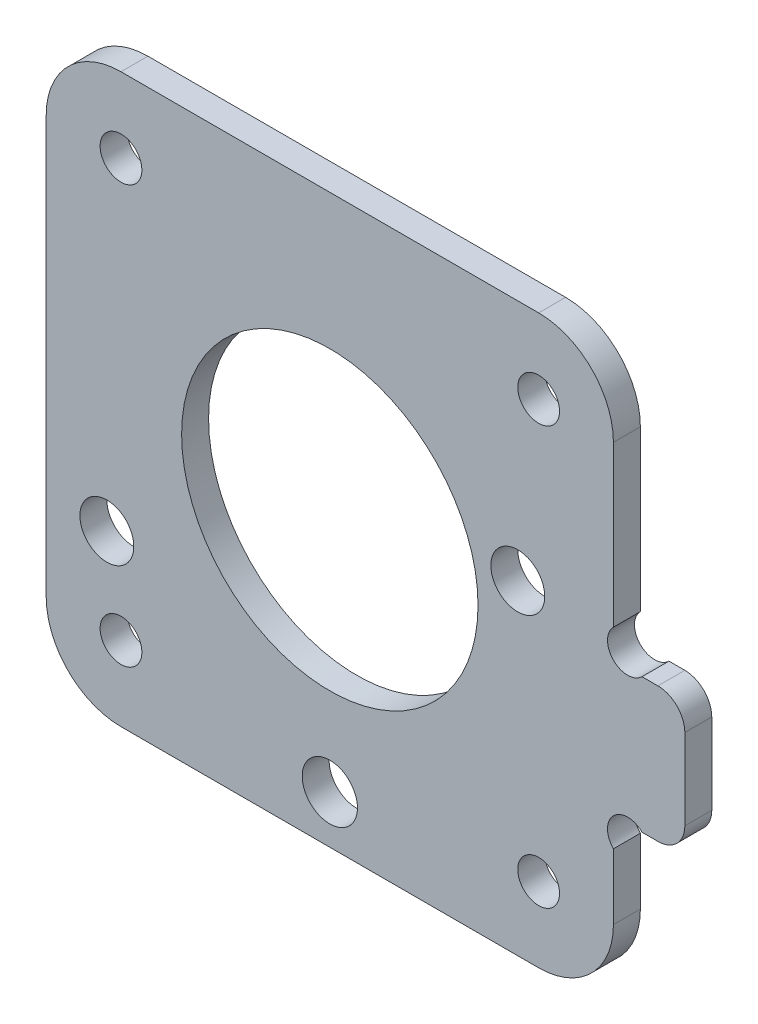
from build123d import *

# Parameters (mm, degrees)
SKETCH1_R           = 11
SKETCH1_R_2         = 1.55
BOSS_EXTRUDE1_DEPTH = 2
SKETCH2_R           = 2.05
CUT_EXTRUDE1_DEPTH  = 30.83630339
SKETCH5_W           = 5.3
SKETCH5_H           = 10
BOSS_EXTRUDE3_DEPTH = 2
FILLET1_R           = 2
SKETCH6_R           = 1.5
CUT_EXTRUDE3_DEPTH  = 34.784981871
SKETCH7_R           = 2
CUT_EXTRUDE6_DEPTH  = 34.784981871


with BuildPart() as part:
    # Sketch1 → Boss-Extrude1 (new body)
    with BuildSketch(Plane.XY):
        with BuildLine():
            Line((-21.05, 15.5), (-21.05, -15.5))
            ThreePointArc((-21.05, -15.5), (-19.424442636, -19.424442636), (-15.5, -21.05))
            Line((-15.5, -21.05), (15.5, -21.05))
            ThreePointArc((15.5, -21.05), (19.424442636, -19.424442636), (21.05, -15.5))
            Line((21.05, -15.5), (21.05, 15.5))
            ThreePointArc((21.05, 15.5), (19.424442636, 19.424442636), (15.5, 21.05))
            Line((15.5, 21.05), (-15.5, 21.05))
            ThreePointArc((-15.5, 21.05), (-19.424442636, 19.424442636), (-21.05, 15.5))
        make_face()
        Circle(SKETCH1_R, mode=Mode.SUBTRACT)
        with Locations((-15.5, -15.5)):
            Circle(SKETCH1_R_2, mode=Mode.SUBTRACT)
        with Locations((15.5, 15.5)):
            Circle(SKETCH1_R_2, mode=Mode.SUBTRACT)
        with Locations(Location((-15.5, 15.5, 0), (0, 0, 180))):
            Circle(SKETCH1_R_2, mode=Mode.SUBTRACT)
        with Locations((15.5, -15.5)):
            Circle(SKETCH1_R_2, mode=Mode.SUBTRACT)
    extrude(amount=BOSS_EXTRUDE1_DEPTH)

    # Sketch2 → Cut-Extrude1 (cut, through all)
    with BuildSketch(Plane.XY.offset(2)):
        with Locations((0, -17.5)):
            Circle(SKETCH2_R)
    extrude(amount=-CUT_EXTRUDE1_DEPTH, mode=Mode.SUBTRACT)

    # Sketch5 → Boss-Extrude3 (add)
    with BuildSketch(Plane(origin=(0, 0, 0), x_dir=(-1, 0, 0), z_dir=(0, 0, -1))):
        with Locations((-23.7, -3.5)):
            Rectangle(SKETCH5_W, SKETCH5_H)
    extrude(amount=-BOSS_EXTRUDE3_DEPTH)

    # Fillet1
    fillet1_edges = [part.edges().sort_by_distance(p)[0] for p in [
        (26.35, -8.5, 1),
        (26.35, 1.5, 1),
    ]]
    fillet(fillet1_edges, radius=FILLET1_R)

    # Sketch6 → Cut-Extrude3 (cut, through all)
    with BuildSketch(Plane.XY.offset(2)):
        with Locations((22.110660172, 2.560660172)):
            Circle(SKETCH6_R)
        with Locations((22.110660172, -9.560660172)):
            Circle(SKETCH6_R)
    extrude(amount=-CUT_EXTRUDE3_DEPTH, mode=Mode.SUBTRACT)

    # Sketch7 → Cut-Extrude6 (cut, through all)
    with BuildSketch(Plane(origin=(0, 0, 0), x_dir=(-1, 0, 0), z_dir=(0, 0, -1))):
        with Locations((-13.95, 3.05)):
            Circle(SKETCH7_R)
        with Locations((16.55, -9)):
            Circle(SKETCH7_R)
    extrude(amount=-CUT_EXTRUDE6_DEPTH, mode=Mode.SUBTRACT)


solid = part.part
